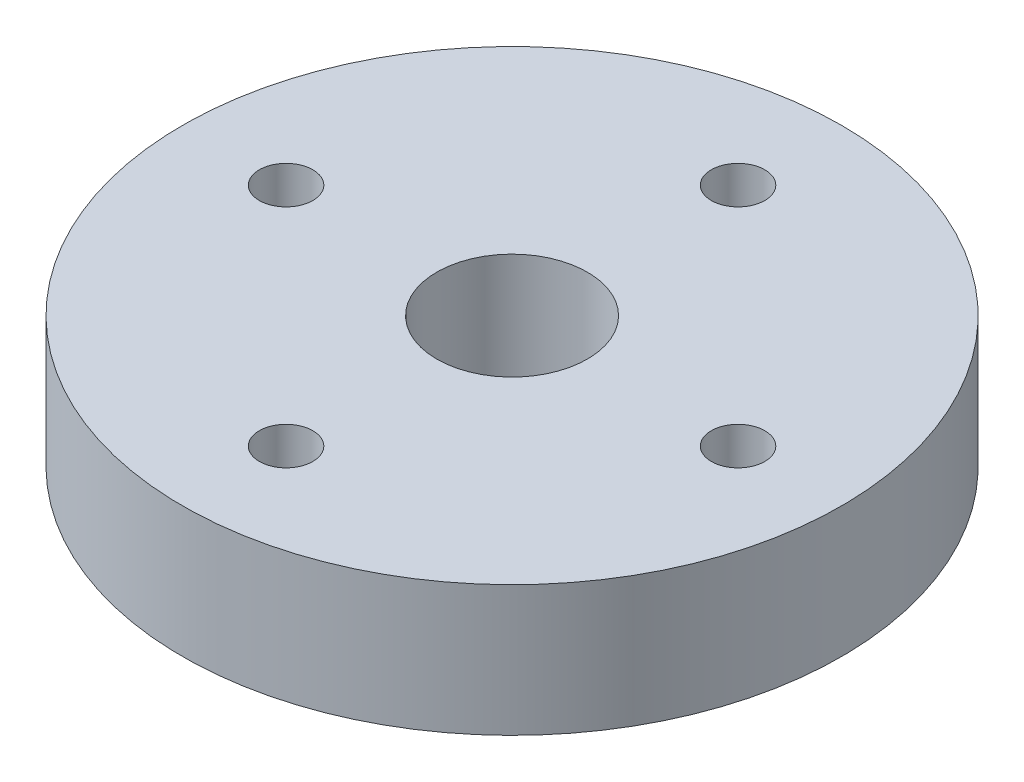
from build123d import *

# Parameters (mm, degrees)
SKETCH1_R           = 17.5
BOSS_EXTRUDE1_DEPTH = 6.93
SKETCH2_R           = 1.418848664
CUT_EXTRUDE1_DEPTH  = 26.700678979
SKETCH3_R           = 4
CUT_EXTRUDE2_DEPTH  = 6.93


with BuildPart() as part:
    # Sketch1 → Boss-Extrude1 (new body)
    with BuildSketch(Plane(origin=(0, 0, 0), x_dir=(1, 0, 0), z_dir=(0, 1, 0))):
        with Locations(Location((0, 0, 0), (0, 0, 90))):
            Circle(SKETCH1_R)
    extrude(amount=BOSS_EXTRUDE1_DEPTH)

    # Sketch2 → Cut-Extrude1 (cut, through all)
    with BuildSketch(Plane(origin=(0, 6.93, 0), x_dir=(1, 0, 0), z_dir=(0, 1, 0))):
        with Locations(Location((0, 12, 0), (0, 0, 270))):
            Circle(SKETCH2_R)
        with Locations(Location((12, 0, 0), (0, 0, 270))):
            Circle(SKETCH2_R)
        with Locations(Location((0, -12, 0), (0, 0, 270))):
            Circle(SKETCH2_R)
        with Locations(Location((-12, 0, 0), (0, 0, 270))):
            Circle(SKETCH2_R)
    extrude(amount=-CUT_EXTRUDE1_DEPTH, mode=Mode.SUBTRACT)

    # Sketch3 → Cut-Extrude2 (cut)
    with BuildSketch(Plane(origin=(0, 6.93, 0), x_dir=(1, 0, 0), z_dir=(0, 1, 0))):
        with Locations(Location((0, 0, 0), (0, 0, 270))):
            Circle(SKETCH3_R)
    extrude(amount=-CUT_EXTRUDE2_DEPTH, mode=Mode.SUBTRACT)


solid = part.part
